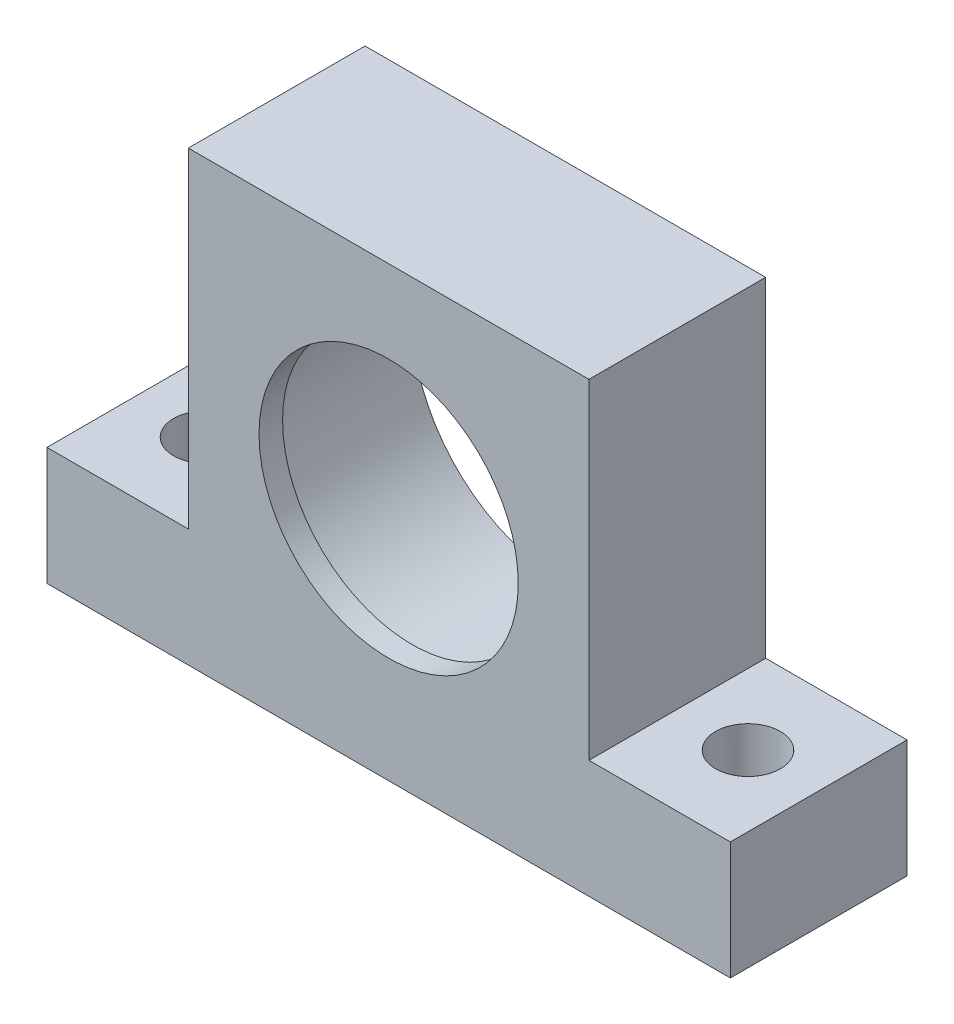
from build123d import *

# Parameters (mm, degrees)
EXTRUDE_1_DEPTH     = 15
SKETCH_2_R          = 11
CUT_EXTRUDE_1_DEPTH = 51.0999002
SKETCH_3_R          = 13
CUT_EXTRUDE_2_DEPTH = 13
SKETCH_4_R          = 2.75
CUT_EXTRUDE_3_DEPTH = 51.0999002


with BuildPart() as part:
    # 草图1 → 凸台-拉伸1 (new body)
    with BuildSketch(Plane.XY):
        Polygon((29, 0), (-29, 0), (-29, 10), (-17, 10), (-17, 38), (17, 38), (17, 10), (29, 10), align=None)
    extrude(amount=EXTRUDE_1_DEPTH)

    # 草图2 → 切除-拉伸1 (cut, through all)
    with BuildSketch(Plane(origin=(0, 0, 0), x_dir=(-1, 0, 0), z_dir=(0, 0, -1))):
        with Locations((0, 20)):
            Circle(SKETCH_2_R)
    extrude(amount=-CUT_EXTRUDE_1_DEPTH, mode=Mode.SUBTRACT)

    # 草图3 → 切除-拉伸2 (cut)
    with BuildSketch(Plane(origin=(0, 0, 0), x_dir=(-1, 0, 0), z_dir=(0, 0, -1))):
        with Locations((0, 20)):
            Circle(SKETCH_3_R)
    extrude(amount=-CUT_EXTRUDE_2_DEPTH, mode=Mode.SUBTRACT)

    # 草图4 → 切除-拉伸3 (cut, through all)
    with BuildSketch(Plane.XZ):
        with Locations(Location((-23, 7.5, 0), (0, 0, 270))):
            Circle(SKETCH_4_R)
        with Locations((23, 7.5)):
            Circle(SKETCH_4_R)
    extrude(amount=-CUT_EXTRUDE_3_DEPTH, mode=Mode.SUBTRACT)


solid = part.part
